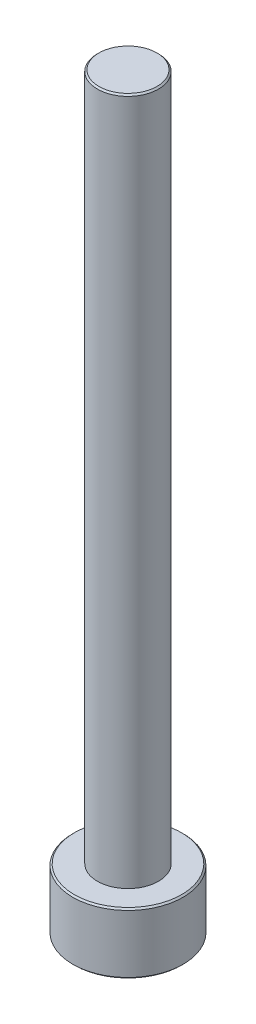
from build123d import *

# Parameters (mm, degrees)
SKETCH_1_R            = 3.61
EXTRUDE_261_DEPTH     = 4
SKETCH_2_R            = 2
EXTRUDE_345_DEPTH     = 45
CUT_EXTRUDE_530_DEPTH = 2
CHAMFER_592_SIZE      = 0.1


with BuildPart() as part:
    # 草图1 → Extrude 261 (new body)
    with BuildSketch(Plane(origin=(0, 0, 0), x_dir=(1, 0, 0), z_dir=(0, 1, 0))):
        with Locations(Location((0, 0, 0), (0, 0, 270))):
            Circle(SKETCH_1_R)
    extrude(amount=EXTRUDE_261_DEPTH)

    # 草图2 → Extrude 345 (add)
    with BuildSketch(Plane(origin=(0, 4, 0), x_dir=(1, 0, 0), z_dir=(0, 1, 0))):
        with Locations(Location((0, 0, 0), (0, 0, 90))):
            Circle(SKETCH_2_R)
    extrude(amount=EXTRUDE_345_DEPTH)

    # 草图3 → Cut-Extrude 530 (cut)
    with BuildSketch(Plane.XZ):
        Polygon((1.54, -0.889119415), (1.54, 0.889119415), (0, 1.778238829), (-1.54, 0.889119415), (-1.54, -0.889119415), (0, -1.778238829), align=None)
    extrude(amount=-CUT_EXTRUDE_530_DEPTH, mode=Mode.SUBTRACT)

    # Chamfer 592
    chamfer_592_edges = [part.edges().sort_by_distance(p)[0] for p in [
        (0, 0, -3.61),
        (0, 4, -3.61),
        (0, 49, 2),
    ]]
    chamfer(chamfer_592_edges, length=CHAMFER_592_SIZE)


solid = part.part
